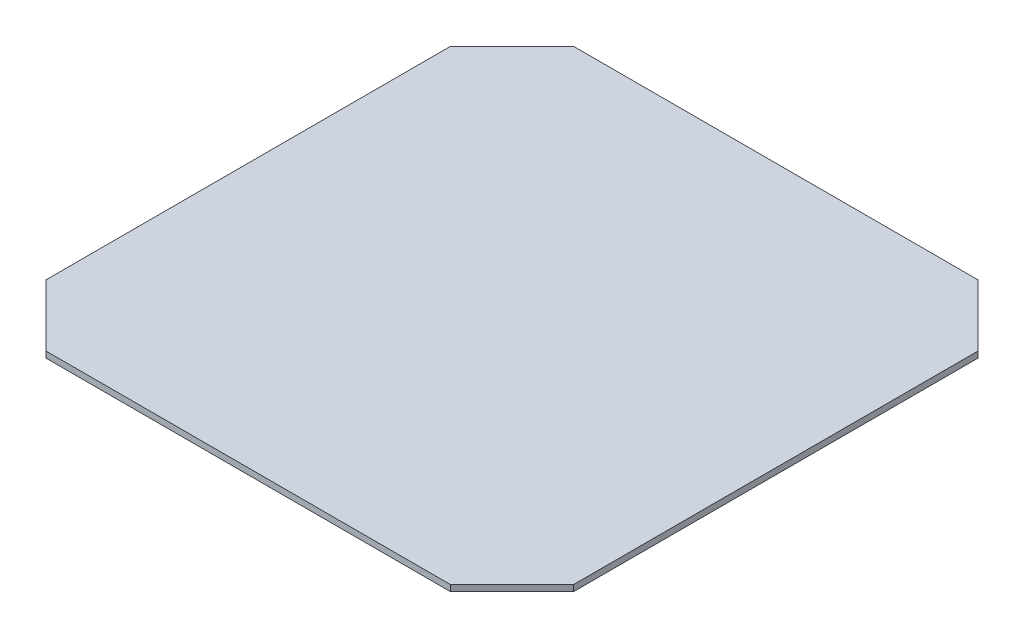
from build123d import *

# Parameters (mm, degrees)
ESBO_O1_W                = 214
ESBO_O1_H                = 214
ESBO_O1_R                = 2.5
RESSALTO_EXTRUS_O1_DEPTH = 1.25
CHANFRO1_SIZE            = 25


with BuildPart() as part:
    # Esboço1 → Ressalto-extrusão1 (new, symmetric)
    with BuildSketch(Plane(origin=(0, 0, 0), x_dir=(1, 0, 0), z_dir=(0, 1, 0))):
        Rectangle(ESBO_O1_W, ESBO_O1_H)
        with Locations(Location((100, 100, 0), (0, 0, 270))):
            Circle(ESBO_O1_R, mode=Mode.SUBTRACT)
        with Locations(Location((-100, 100, 0), (0, 0, 90))):
            Circle(ESBO_O1_R, mode=Mode.SUBTRACT)
        with Locations(Location((100, -100, 0), (0, 0, 90))):
            Circle(ESBO_O1_R, mode=Mode.SUBTRACT)
        with Locations(Location((-100, -100, 0), (0, 0, 270))):
            Circle(ESBO_O1_R, mode=Mode.SUBTRACT)
    extrude(amount=RESSALTO_EXTRUS_O1_DEPTH, both=True)

    # Chanfro1
    chanfro1_edges = [part.edges().sort_by_distance(p)[0] for p in [
        (-107, 0, 107),
        (107, 0, 107),
        (107, 0, -107),
        (-107, 0, -107),
    ]]
    chamfer(chanfro1_edges, length=CHANFRO1_SIZE)


solid = part.part
